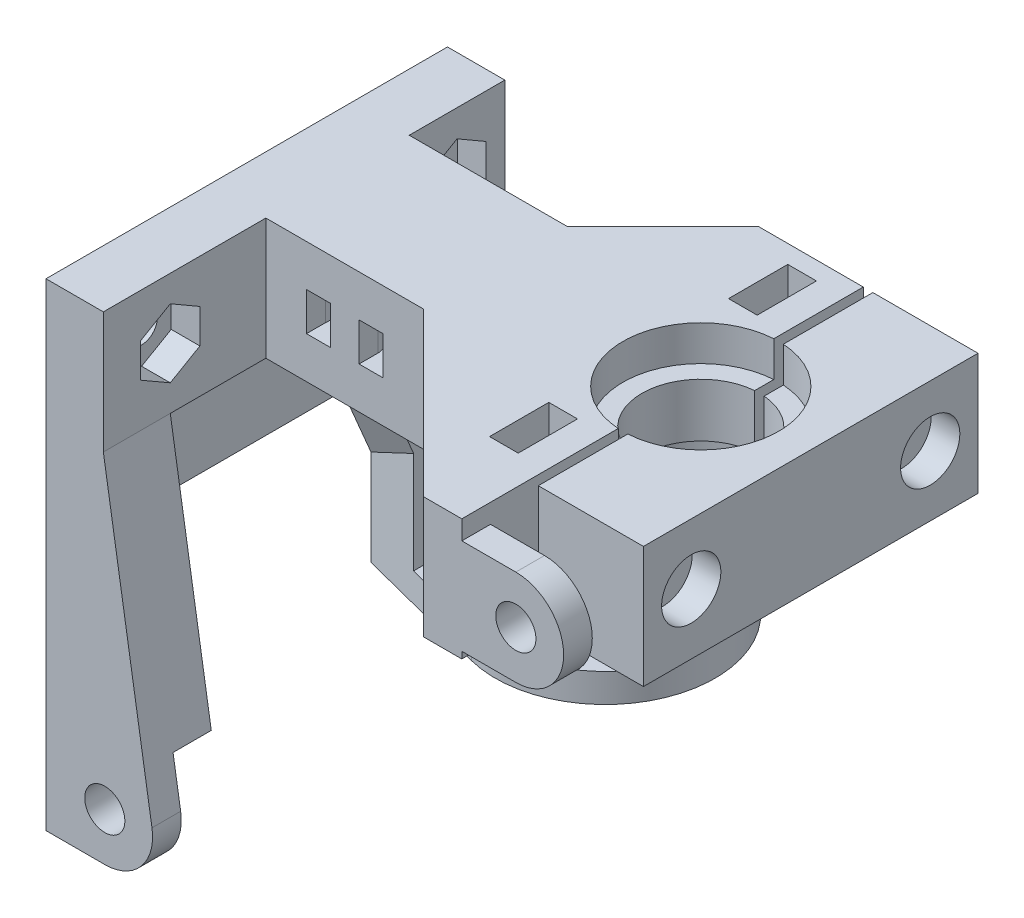
from build123d import *

# Parameters (mm, degrees)
SKETCH_13_R               = 6.15
EXTRUDE_4_DEPTH           = 12.7
CUT_EXTRUDE_11_DEPTH      = 0.5
CUT_EXTRUDE_11_DEPTH_BACK = 0.5
SKETCH_15_W               = 35
SKETCH_15_H               = 12.7
SKETCH_14_R               = 3.1
SKETCH_14_R_2             = 1.65
CUT_EXTRUDE_12_DEPTH      = 3
SKETCH_14_3_R             = 1.65
CUT_EXTRUDE_13_DEPTH      = 25
SKETCH_16_W               = 6.2
SKETCH_16_H               = 12.7
CUT_EXTRUDE_14_DEPTH      = 3
SKETCH_17_R               = 8.15
SKETCH_17_R_2             = 6.15
CUT_EXTRUDE_30_DEPTH      = 3.7
CUT_EXTRUDE_31_DEPTH      = 3.4
SKETCH_19_R               = 1.65
CUT_EXTRUDE_32_DEPTH      = 6
CUT_EXTRUDE_33_DEPTH      = 3
SKETCH_21_W               = 3
SKETCH_21_H               = 35
EXTRUDE_5_DEPTH           = 10
SKETCH_22_R               = 2.1
EXTRUDE_6_DEPTH           = 7
SKETCH_41_W               = 15.059328192
SKETCH_41_H               = 11.44904226
CUT_EXTRUDE_34_DEPTH      = 4
SKETCH_42_W               = 10.65
SKETCH_42_H               = 4
CUT_EXTRUDE_35_DEPTH      = 10
CUT_EXTRUDE_36_DEPTH      = 12.7
EXTRUDE_7_DEPTH           = 12.7
EXTRUDE_START             = -6
EXTRUDE_8_DEPTH           = 6
SKETCH_44_R               = 6.5
EXTRUDE_9_DEPTH           = 3
EXTRUDE_14_DEPTH          = 3
CUT_EXTRUDE_37_DEPTH      = 2
CUT_EXTRUDE_37_DEPTH_BACK = 2
SKETCH_46_R               = 1.65
EXTRUDE_12_DEPTH          = 0.2
SKETCH_47_R               = 1.65
EXTRUDE_13_DEPTH          = 0.2
EXTRUDE_15_REACH          = 75.95
EXTRUDE_16_REACH          = 75.95
SKETCH_49_R               = 1.65
CUT_EXTRUDE_38_DEPTH      = 6
SKETCH_50_R               = 1.65
CUT_EXTRUDE_39_DEPTH      = 3


with BuildPart() as part:
    # 草圖13 → 填料-伸長4 (new body)
    with BuildSketch(Plane(origin=(0, 0, 0), x_dir=(1, 0, 0), z_dir=(0, 1, 0))):
        Polygon((0, 17.5), (0, -17.5), (6, -17.5), (6, -7.5), (22.5, -7.5), (32.5, -17.5), (55.5, -17.5), (55.5, 17.5), (32.5, 17.5), (22.5, 7.5), (6, 7.5), (6, 17.5), align=None)
        with Locations(Location((44, 0, 0), (0, 0, 270))):
            Circle(SKETCH_13_R, mode=Mode.SUBTRACT)
    extrude(amount=-EXTRUDE_4_DEPTH)

    # 草圖15 → 除料-伸長11 (cut, two sides: drawn at the far end of the back side and taken through both)
    with BuildSketch(Plane.ZY.offset(-44).offset(-CUT_EXTRUDE_11_DEPTH_BACK)):
        with Locations((0, -6.35)):
            Rectangle(SKETCH_15_W, SKETCH_15_H)
    extrude(amount=CUT_EXTRUDE_11_DEPTH + CUT_EXTRUDE_11_DEPTH_BACK, mode=Mode.SUBTRACT)


with BuildPart() as cut_extrude_11_piece_1:
    # of the separate pieces the step leaves, piece 1, a body of its own (cut_extrude_11_pieces)
    add(part.part.solids().sort_by_distance((0, 0, -17.5))[0])


with BuildPart() as cut_extrude_11_piece_2:
    # of the separate pieces the step leaves, piece 2, a body of its own (cut_extrude_11_pieces)
    add(part.part.solids().sort_by_distance((55.5, 0, -17.5))[0])

    # 草圖14 → 除料-伸長12 (cut)
    # profile 1 of 2: a face of its own
    with BuildSketch(Plane.ZY.offset(-55.5)):
        with Locations(Location((-12.5, -6.35, 0), (0, 0, 180))):
            Circle(SKETCH_14_R)
        with Locations(Location((-12.5, -6.35, 0), (0, 0, 180))):
            Circle(SKETCH_14_R_2, mode=Mode.SUBTRACT)
    # profile 2 of 2: a face of its own
    with BuildSketch(Plane.ZY.offset(-55.5)):
        with Locations(Location((12.5, -6.35, 0), (0, 0, 180))):
            Circle(SKETCH_14_R)
        with Locations(Location((12.5, -6.35, 0), (0, 0, 180))):
            Circle(SKETCH_14_R_2, mode=Mode.SUBTRACT)
    extrude(amount=CUT_EXTRUDE_12_DEPTH, mode=Mode.SUBTRACT)


with BuildPart() as cut_extrude_13_tool:
    # 草圖14<3> → 除料-伸長13 (new body)
    with BuildSketch(Plane.ZY.offset(-55.5)):
        with Locations(Location((-12.5, -6.35, 0), (0, 0, 180))):
            Circle(SKETCH_14_3_R)
        with Locations(Location((12.5, -6.35, 0), (0, 0, 180))):
            Circle(SKETCH_14_3_R)
    extrude(amount=CUT_EXTRUDE_13_DEPTH)


with BuildPart() as cut_extrude_11_piece_1_1:
    add(cut_extrude_11_piece_1.part)

    # 除料-伸長13: cut by cut_extrude_13_tool
    add(cut_extrude_13_tool.part, mode=Mode.SUBTRACT)

    # 草圖16 → 除料-伸長14 (cut)
    with BuildSketch(Plane(origin=(37.5, 0, 0), x_dir=(0, 0, -1), z_dir=(1, 0, 0))):
        with Locations((-12.5, -6.35)):
            Rectangle(SKETCH_16_W, SKETCH_16_H)
        with Locations((12.5, -6.35)):
            Rectangle(SKETCH_16_W, SKETCH_16_H)
    extrude(amount=CUT_EXTRUDE_14_DEPTH, mode=Mode.SUBTRACT)


with BuildPart() as cut_extrude_11_piece_2_1:
    add(cut_extrude_11_piece_2.part)

    # 除料-伸長13: cut by cut_extrude_13_tool
    add(cut_extrude_13_tool.part, mode=Mode.SUBTRACT)


with BuildPart() as cut_extrude_30_tool:
    # 草圖17 → 除料-伸長30 (new body)
    with BuildSketch(Plane(origin=(0, 0, 0), x_dir=(1, 0, 0), z_dir=(0, 1, 0))):
        with Locations((44, 0)):
            Circle(SKETCH_17_R)
        with Locations((44, 0)):
            Circle(SKETCH_17_R_2, mode=Mode.SUBTRACT)
    extrude(amount=-CUT_EXTRUDE_30_DEPTH)


with BuildPart() as cut_extrude_11_piece_1_2:
    add(cut_extrude_11_piece_1_1.part)

    # 除料-伸長30: cut by cut_extrude_30_tool
    add(cut_extrude_30_tool.part, mode=Mode.SUBTRACT)


with BuildPart() as cut_extrude_11_piece_2_2:
    add(cut_extrude_11_piece_2_1.part)

    # 除料-伸長30: cut by cut_extrude_30_tool
    add(cut_extrude_30_tool.part, mode=Mode.SUBTRACT)


with BuildPart() as cut_extrude_31_tool:
    # 草圖18 → 除料-伸長31 (new body)
    with BuildSketch(Plane.XZ.offset(12.7)):
        with BuildLine():
            ThreePointArc((43.5, -8.134648118), (49.583345771, -5.937065774), (52.15, 0))
            ThreePointArc((52.15, 0), (49.583345771, 5.937065774), (43.5, 8.134648118))
            Line((43.5, 8.134648118), (43.5, 6.129641099))
            ThreePointArc((43.5, 6.129641099), (48.168183057, 4.522029412), (50.15, 0))
            ThreePointArc((50.15, 0), (48.168183057, -4.522029412), (43.5, -6.129641099))
            Line((43.5, -6.129641099), (43.5, -8.134648118))
        make_face()
        with BuildLine():
            Line((43.5, 6.129641099), (43.5, 8.134648118))
            ThreePointArc((43.5, 8.134648118), (35.85, 0), (43.5, -8.134648118))
            Line((43.5, -8.134648118), (43.5, -6.129641099))
            ThreePointArc((43.5, -6.129641099), (37.85, 0), (43.5, 6.129641099))
        make_face()
    extrude(amount=-CUT_EXTRUDE_31_DEPTH)


with BuildPart() as cut_extrude_11_piece_1_3:
    add(cut_extrude_11_piece_1_2.part)

    # 除料-伸長31: cut by cut_extrude_31_tool
    add(cut_extrude_31_tool.part, mode=Mode.SUBTRACT)

    # 草圖19 → 除料-伸長32 (cut)
    with BuildSketch(Plane.ZY):
        with Locations(Location((-12.5, -6.35, 0), (0, 0, 180))):
            Circle(SKETCH_19_R)
    extrude(amount=-CUT_EXTRUDE_32_DEPTH, mode=Mode.SUBTRACT)

    # 草圖20 → 除料-伸長33 (cut)
    with BuildSketch(Plane(origin=(6, 0, 0), x_dir=(0, 0, -1), z_dir=(1, 0, 0))):
        Polygon((15.55, -8.110918321), (15.55, -4.589081679), (12.5, -2.828163358), (9.45, -4.589081679), (9.45, -8.110918321), (12.5, -9.871836642), align=None)
    extrude(amount=-CUT_EXTRUDE_33_DEPTH, mode=Mode.SUBTRACT)

    # 草圖21 → 填料-伸長5 (add)
    with BuildSketch(Plane.XZ.offset(12.7)):
        with Locations((1.5, 0)):
            Rectangle(SKETCH_21_W, SKETCH_21_H)
    extrude(amount=EXTRUDE_5_DEPTH)



with BuildPart() as cut_extrude_11_piece_2_3:
    add(cut_extrude_11_piece_2_2.part)

    # 除料-伸長31: cut by cut_extrude_31_tool
    add(cut_extrude_31_tool.part, mode=Mode.SUBTRACT)


with BuildPart() as cut_extrude_11_piece_1_4:
    add(cut_extrude_11_piece_1_3.part)

    add(cut_extrude_11_piece_2_3.part)  # 填料-伸長6 merges 除料-伸長11 piece 2
    # 草圖22 → 填料-伸長6 (add)
    # profile 1 of 2: a face of its own
    with BuildSketch(Plane.XY.offset(24.5)):
        with BuildLine():
            Line((6, 0), (0, 0))
            Line((0, 0), (0, -50))
            Line((0, -50), (6.15, -50))
            ThreePointArc((6.15, -50), (9.956874308, -48.241559502), (11.086083834, -44.203083202))
            Line((11.086083834, -44.203083202), (6, -12.7))
            Line((6, -12.7), (6, 0))
        make_face()
        with Locations((6.15, -45)):
            Circle(SKETCH_22_R, mode=Mode.SUBTRACT)
    # profile 2 of 2: a face of its own
    with BuildSketch(Plane.XY.offset(24.5)):
        with BuildLine():
            Line((43.5, -12), (49.15, -12))
            ThreePointArc((49.15, -12), (54.15, -7), (49.15, -2))
            Line((49.15, -2), (43.5, -2))
            Line((43.5, -2), (43.5, 0))
            Line((43.5, 0), (38, 0))
            Line((38, 0), (38, -12.7))
            Line((38, -12.7), (43.5, -12.7))
            Line((43.5, -12.7), (43.5, -12))
        make_face()
        with Locations((49.15, -7)):
            Circle(SKETCH_22_R, mode=Mode.SUBTRACT)
    extrude(amount=-EXTRUDE_6_DEPTH)

    # 草圖41 → 除料-伸長34 (cut)
    with BuildSketch(Plane(origin=(0, 0, 17.5), x_dir=(-1, 0, 0), z_dir=(0, 0, -1))):
        with Locations((-6.15, -45)):
            Rectangle(SKETCH_41_W, SKETCH_41_H)
    extrude(amount=-CUT_EXTRUDE_34_DEPTH, mode=Mode.SUBTRACT)

    # 草圖42 → 除料-伸長35 (cut)
    with BuildSketch(Plane(origin=(0, -2, 0), x_dir=(1, 0, 0), z_dir=(0, 1, 0))):
        with Locations((48.825, -19.5)):
            Rectangle(SKETCH_42_W, SKETCH_42_H)
    extrude(amount=-CUT_EXTRUDE_35_DEPTH, mode=Mode.SUBTRACT)


with BuildPart() as cut_extrude_35_piece_1:
    # of the separate pieces the step leaves, piece 1, a body of its own (cut_extrude_35_pieces)
    add(cut_extrude_11_piece_1_4.part.solids().sort_by_distance((43.5, -12.7, 8.134648118))[0])

    # 草圖43 → 除料-伸長36 (cut)
    with BuildSketch(Plane(origin=(0, 0, 0), x_dir=(1, 0, 0), z_dir=(0, 1, 0))):
        Polygon((39.5, -24.5), (38, -23), (38, -24.5), align=None)
    extrude(amount=-CUT_EXTRUDE_36_DEPTH, mode=Mode.SUBTRACT)

    # 草圖43<3> → 填料-伸長7 (add)
    with BuildSketch(Plane(origin=(0, 0, 0), x_dir=(1, 0, 0), z_dir=(0, 1, 0))):
        Polygon((38, -17.5), (32.5, -17.5), (38, -23), align=None)
    extrude(amount=-EXTRUDE_7_DEPTH)

    # 草圖34 → 填料-伸長8 (add)
    with BuildSketch(Plane(origin=(6, 0, 0), x_dir=(0, 0, -1), z_dir=(1, 0, 0)).offset(EXTRUDE_START)):
        Polygon((24.5, -32.7), (17.5, -16.200874589), (17.5, -22.7), (9.5, -22.7), (9.5, -32.7), (9.5, -42.7), (24.5, -42.7), align=None)
        Polygon((9.5, -32.7), (9.5, -22.7), (5.257350874, -22.7), align=None)
    extrude(amount=EXTRUDE_8_DEPTH)

    # 草圖44 → 填料-伸長9 (add)
    with BuildSketch(Plane.XZ.offset(42.7)):
        with BuildLine():
            Line((6, -24.5), (0, -24.5))
            Line((0, -24.5), (14.134039996, -28.137157324))
            ThreePointArc((14.134039996, -28.137157324), (28.5, -17), (14.134039996, -5.862842676))
            Line((14.134039996, -5.862842676), (0, -9.5))
            Line((0, -9.5), (6, -9.5))
            Line((6, -9.5), (6, -24.5))
        make_face()
        with Locations(Location((17, -17, 0), (0, 0, 270))):
            Circle(SKETCH_44_R, mode=Mode.SUBTRACT)
    extrude(amount=-EXTRUDE_9_DEPTH)

    # 草圖34<5> → 填料-伸長14 (add)
    with BuildSketch(Plane(origin=(6, 0, 0), x_dir=(0, 0, -1), z_dir=(1, 0, 0))):
        Polygon((17.5, -12.7), (9.5, -12.7), (5.257350874, -12.7), (5.257350874, -22.7), (17.5, -22.7), align=None)
    extrude(amount=-EXTRUDE_14_DEPTH)

    # 草圖39 → 除料-伸長37 (cut, two sides: drawn at the far end of the back side and taken through both)
    with BuildSketch(Plane(origin=(0, -6.35, 0), x_dir=(1, 0, 0), z_dir=(0, 1, 0)).offset(-CUT_EXTRUDE_37_DEPTH_BACK)):
        with BuildLine():
            Line((12.75, -7.5), (12.75, -5.5))
            ThreePointArc((12.75, -5.5), (14.25, -4), (15.75, -5.5))
            Line((15.75, -5.5), (15.75, -7.5))
            Line((15.75, -7.5), (17.714101615, -7.5))
            ThreePointArc((17.714101615, -7.5), (18.113703305, -6.53527618), (18.25, -5.5))
            ThreePointArc((18.25, -5.5), (14.25, -1.5), (10.25, -5.5))
            ThreePointArc((10.25, -5.5), (10.386296695, -6.53527618), (10.785898385, -7.5))
            Line((10.785898385, -7.5), (12.75, -7.5))
        make_face()
        with BuildLine():
            Line((10.25, -7.5), (10.785898385, -7.5))
            ThreePointArc((10.785898385, -7.5), (10.386296695, -6.53527618), (10.25, -5.5))
            Line((10.25, -5.5), (10.25, -7.5))
        make_face()
        with BuildLine():
            ThreePointArc((18.25, -5.5), (18.113703305, -6.53527618), (17.714101615, -7.5))
            Line((17.714101615, -7.5), (18.25, -7.5))
            Line((18.25, -7.5), (18.25, -5.5))
        make_face()
    extrude(amount=CUT_EXTRUDE_37_DEPTH + CUT_EXTRUDE_37_DEPTH_BACK, mode=Mode.SUBTRACT)

    # 草圖47 → 填料-伸長13 (add)
    with BuildSketch(Plane.ZY.offset(-40.5)):
        with Locations(Location((12.5, -6.35, 0), (0, 0, 180))):
            Circle(SKETCH_47_R)
        with Locations(Location((-12.5, -6.35, 0), (0, 0, 180))):
            Circle(SKETCH_47_R)
    extrude(amount=-EXTRUDE_13_DEPTH)

    # 填料-伸長15: up to this face of the body (flat: up to its plane)
    extrude_15_end = Plane(cut_extrude_35_piece_1.part.faces().sort_by_distance((3, -24.450437294, -21))[0])
    # 草圖48 → 填料-伸長15 (add, up to the picked face)
    with BuildSketch(Plane(origin=(0, -39.7, 0), x_dir=(1, 0, 0), z_dir=(0, 1, 0)), mode=Mode.PRIVATE) as extrude_15_sk1:
        Polygon((0, 24.5), (6, 24.5), (6, 26.043999023), align=None)
    extrude_15_tool1 = split(extrude(extrude_15_sk1.sketch, amount=EXTRUDE_15_REACH, mode=Mode.PRIVATE), bisect_by=extrude_15_end, keep=Keep.BOTH, mode=Mode.PRIVATE)
    add(extrude_15_tool1.solids().sort_by(Axis((4, -39.7, -25.014666), (0, 1, 0)))[0])

    # 填料-伸長16: up to this face of the body (flat: up to its plane)
    extrude_16_end = Plane(cut_extrude_35_piece_1.part.faces().sort_by_distance((3, -27.7, -7.378675437))[0])
    # 草圖48<3> → 填料-伸長16 (add, up to the picked face)
    with BuildSketch(Plane(origin=(0, -39.7, 0), x_dir=(1, 0, 0), z_dir=(0, 1, 0)), mode=Mode.PRIVATE) as extrude_16_sk1:
        Polygon((6, 9.5), (0, 9.5), (6, 7.956000977), align=None)
    extrude_16_tool1 = split(extrude(extrude_16_sk1.sketch, amount=EXTRUDE_16_REACH, mode=Mode.PRIVATE), bisect_by=extrude_16_end, keep=Keep.BOTH, mode=Mode.PRIVATE)
    add(extrude_16_tool1.solids().sort_by(Axis((4, -39.7, -8.985334), (0, 1, 0)))[0])

    # 草圖49 → 除料-伸長38 (cut)
    with BuildSketch(Plane.ZY):
        with Locations((17.5, -6.35)):
            Circle(SKETCH_49_R)
    extrude(amount=-CUT_EXTRUDE_38_DEPTH, mode=Mode.SUBTRACT)

    # 草圖50 → 除料-伸長39 (cut)
    with BuildSketch(Plane(origin=(6, 0, 0), x_dir=(0, 0, -1), z_dir=(1, 0, 0))):
        Polygon((-14.4, -8.139785834), (-14.4, -4.560214166), (-17.5, -2.770428331), (-20.6, -4.560214166), (-20.6, -8.139785834), (-17.5, -9.929571669), align=None)
        with Locations(Location((-17.5, -6.35, 0), (0, 0, 180))):
            Circle(SKETCH_50_R, mode=Mode.SUBTRACT)
    extrude(amount=-CUT_EXTRUDE_39_DEPTH, mode=Mode.SUBTRACT)


with BuildPart() as cut_extrude_35_piece_2:
    # of the separate pieces the step leaves, piece 2, a body of its own (cut_extrude_35_pieces)
    add(cut_extrude_11_piece_1_4.part.solids().sort_by_distance((55.5, 0, 17.5))[0])

    # 草圖46 → 填料-伸長12 (add)
    with BuildSketch(Plane(origin=(52.5, 0, 0), x_dir=(0, 0, -1), z_dir=(1, 0, 0))):
        with Locations((-12.5, -6.35)):
            Circle(SKETCH_46_R)
        with Locations(Location((12.5, -6.35, 0), (0, 0, 180))):
            Circle(SKETCH_46_R)
    extrude(amount=-EXTRUDE_12_DEPTH)


solid = Compound([cut_extrude_35_piece_1.part, cut_extrude_35_piece_2.part])
